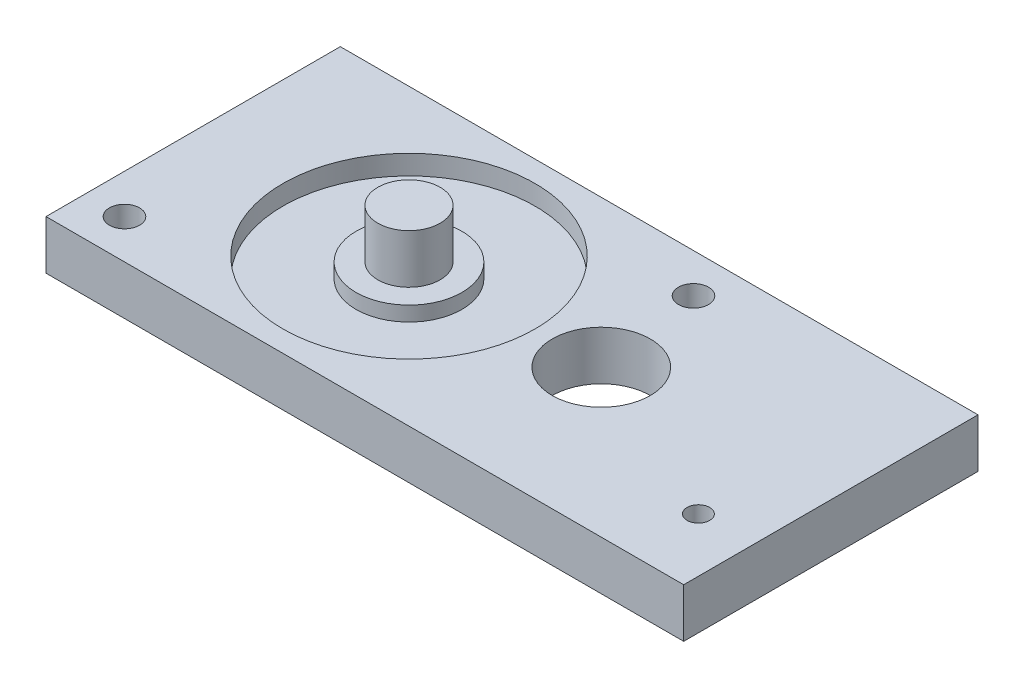
from build123d import *

# Parameters (mm, degrees)
SKETCH1_W           = 57
SKETCH1_H           = 30
BOSS_EXTRUDE1_DEPTH = 5
SKETCH2_R           = 3.175
BOSS_EXTRUDE2_DEPTH = 4.5
SKETCH3_R           = 1.5367
CUT_EXTRUDE1_DEPTH  = 5
SKETCH4_R           = 12.85
SKETCH4_R_2         = 5.4
CUT_EXTRUDE2_DEPTH  = 2
SKETCH5_R           = 5
CUT_EXTRUDE3_DEPTH  = 10
SKETCH6_W           = 8
SKETCH6_H           = 30
BOSS_EXTRUDE3_DEPTH = 5
SKETCH7_R           = 5.4
SKETCH7_R_2         = 3.175
CUT_EXTRUDE4_DEPTH  = 0.5
SKETCH8_R           = 1.15
CUT_EXTRUDE5_DEPTH  = 15


with BuildPart() as part:
    # Sketch1 → Boss-Extrude1 (new body)
    with BuildSketch(Plane(origin=(0, 0, 0), x_dir=(1, 0, 0), z_dir=(0, 1, 0))):
        with Locations((6.5, 0)):
            Rectangle(SKETCH1_W, SKETCH1_H)
    extrude(amount=BOSS_EXTRUDE1_DEPTH)

    # Sketch2 → Boss-Extrude2 (add)
    with BuildSketch(Plane(origin=(0, 5, 0), x_dir=(1, 0, 0), z_dir=(0, 1, 0))):
        with Locations(Location((0, 0, 0), (0, 0, 270))):
            Circle(SKETCH2_R)
    extrude(amount=BOSS_EXTRUDE2_DEPTH)

    # Sketch3 → Cut-Extrude1 (cut)
    with BuildSketch(Plane(origin=(0, 5, 0), x_dir=(1, 0, 0), z_dir=(0, 1, 0))):
        with Locations(Location((-18, -11, 0), (0, 0, 270))):
            Circle(SKETCH3_R)
        with Locations(Location((18, 11, 0), (0, 0, 270))):
            Circle(SKETCH3_R)
    extrude(amount=-CUT_EXTRUDE1_DEPTH, mode=Mode.SUBTRACT)

    # Sketch4 → Cut-Extrude2 (cut)
    with BuildSketch(Plane(origin=(0, 5, 0), x_dir=(1, 0, 0), z_dir=(0, 1, 0))):
        with Locations(Location((0, 0, 0), (0, 0, 270))):
            Circle(SKETCH4_R)
        with Locations(Location((0, 0, 0), (0, 0, 270))):
            Circle(SKETCH4_R_2, mode=Mode.SUBTRACT)
    extrude(amount=-CUT_EXTRUDE2_DEPTH, mode=Mode.SUBTRACT)

    # Sketch5 → Cut-Extrude3 (cut)
    with BuildSketch(Plane(origin=(0, 5, 0), x_dir=(1, 0, 0), z_dir=(0, 1, 0))):
        with Locations(Location((19.6, 0, 0), (0, 0, 270))):
            Circle(SKETCH5_R)
    extrude(amount=-CUT_EXTRUDE3_DEPTH, mode=Mode.SUBTRACT)

    # Sketch6 → Boss-Extrude3 (add)
    with BuildSketch(Plane(origin=(0, 5, 0), x_dir=(1, 0, 0), z_dir=(0, 1, 0))):
        with Locations((39, 0)):
            Rectangle(SKETCH6_W, SKETCH6_H)
    extrude(amount=-BOSS_EXTRUDE3_DEPTH)

    # Sketch7 → Cut-Extrude4 (cut)
    with BuildSketch(Plane(origin=(0, 5, 0), x_dir=(1, 0, 0), z_dir=(0, 1, 0))):
        with Locations(Location((0, 0, 0), (0, 0, 270))):
            Circle(SKETCH7_R)
        with Locations(Location((0, 0, 0), (0, 0, 270))):
            Circle(SKETCH7_R_2, mode=Mode.SUBTRACT)
    extrude(amount=-CUT_EXTRUDE4_DEPTH, mode=Mode.SUBTRACT)

    # Sketch8 → Cut-Extrude5 (cut)
    with BuildSketch(Plane(origin=(0, 5, 0), x_dir=(1, 0, 0), z_dir=(0, 1, 0))):
        with Locations(Location((37.5, -8, 0), (0, 0, 270))):
            Circle(SKETCH8_R)
    extrude(amount=-CUT_EXTRUDE5_DEPTH, mode=Mode.SUBTRACT)


solid = part.part
